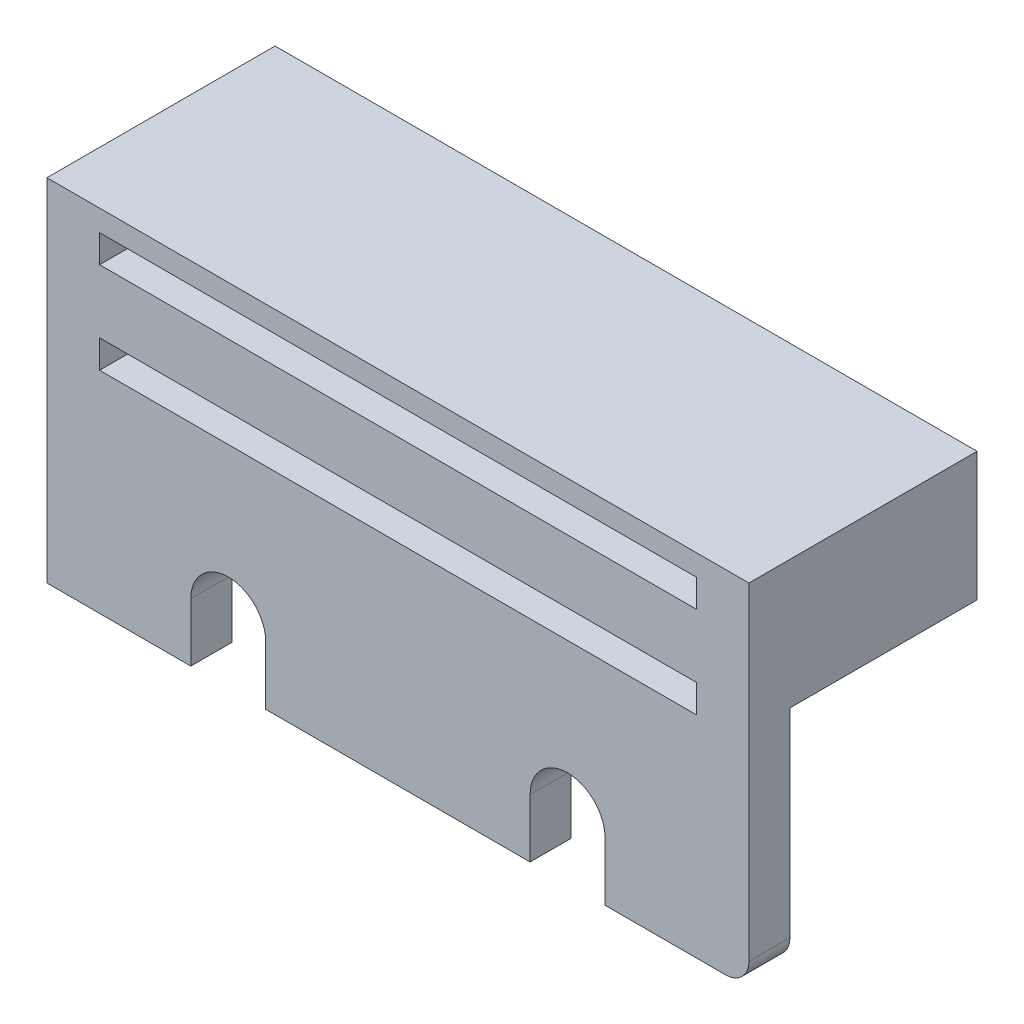
from build123d import *

# Parameters (mm, degrees)
BOSS_EXTRUDE1_DEPTH      = 27.75
BOSS_EXTRUDE1_DEPTH_BACK = 27.75
SKETCH1_W                = 30
SKETCH1_H                = 15
SKETCH3_W                = 4
SKETCH3_H                = 18.5
CUT_EXTRUDE2_DEPTH       = 43.072110715
CUT_EXTRUDE5_DEPTH       = 3
CUT_EXTRUDE6_START       = -3
CUT_EXTRUDE6_DEPTH       = 3
FILLET1_R                = 1
SKETCH7_W                = 52
SKETCH7_H                = 19
CUT_EXTRUDE8_DEPTH       = 43.072110715
SKETCH8_W                = 25.5
SKETCH8_H                = 1.2
SKETCH8_H_2              = 1.187456806
CUT_EXTRUDE9_DEPTH       = 21.495426319


with BuildPart() as part:
    # Sketch1 → Boss-Extrude1 (new, two sides: drawn at the far end of the back side and taken through both)
    with BuildSketch(Plane.XY.offset(-BOSS_EXTRUDE1_DEPTH_BACK)):
        with Locations((0, -2.5)):
            Rectangle(SKETCH1_W, SKETCH1_H)
    extrude(amount=BOSS_EXTRUDE1_DEPTH + BOSS_EXTRUDE1_DEPTH_BACK)

    # Sketch3 → Cut-Extrude2 (cut, through all)
    with BuildSketch(Plane(origin=(15, 0, 0), x_dir=(0, 0, -1), z_dir=(1, 0, 0))):
        with Locations((24, -10)):
            Rectangle(SKETCH3_W, SKETCH3_H)
        with Locations((-24, -10)):
            Rectangle(SKETCH3_W, SKETCH3_H)
    extrude(amount=-CUT_EXTRUDE2_DEPTH, mode=Mode.SUBTRACT)

    # Sketch2 → Cut-Extrude5 (cut)
    with BuildSketch(Plane.XY.offset(27.75)):
        with BuildLine():
            Line((-8.85, -12.5), (-8.85, -7.5))
            ThreePointArc((-8.85, -7.5), (-7.25, -5.9), (-5.65, -7.5))
            Line((-5.65, -7.5), (-5.65, -12.5))
            ThreePointArc((-5.65, -12.5), (-7.25, -14.1), (-8.85, -12.5))
        make_face()
        with BuildLine():
            Line((5.65, -12.5), (5.65, -7.5))
            ThreePointArc((5.65, -7.5), (7.25, -5.9), (8.85, -7.5))
            Line((8.85, -7.5), (8.85, -12.5))
            ThreePointArc((8.85, -12.5), (7.25, -14.1), (5.65, -12.5))
        make_face()
    extrude(amount=-CUT_EXTRUDE5_DEPTH, mode=Mode.SUBTRACT)

    # Sketch5 → Cut-Extrude6 (cut)
    with BuildSketch(Plane(origin=(0, 0, -27.75), x_dir=(-1, 0, 0), z_dir=(0, 0, -1)).offset(CUT_EXTRUDE6_START)):
        with BuildLine():
            Line((-8.85, -12.5), (-8.85, -7.5))
            ThreePointArc((-8.85, -7.5), (-7.25, -5.9), (-5.65, -7.5))
            Line((-5.65, -7.5), (-5.65, -12.5))
            ThreePointArc((-5.65, -12.5), (-7.25, -14.1), (-8.85, -12.5))
        make_face()
        with BuildLine():
            Line((5.65, -12.5), (5.65, -7.5))
            ThreePointArc((5.65, -7.5), (7.25, -5.9), (8.85, -7.5))
            Line((8.85, -7.5), (8.85, -12.5))
            ThreePointArc((8.85, -12.5), (7.25, -14.1), (5.65, -12.5))
        make_face()
    extrude(amount=CUT_EXTRUDE6_DEPTH, mode=Mode.SUBTRACT)

    # Fillet1
    fillet1_edges = [part.edges().sort_by_distance(p)[0] for p in [
        (15, -10, 26.875),
    ]]
    fillet(fillet1_edges, radius=FILLET1_R)

    # Sketch7 → Cut-Extrude8 (cut, through all)
    with BuildSketch(Plane(origin=(15, 0, 0), x_dir=(0, 0, -1), z_dir=(1, 0, 0))):
        with Locations((0, -10)):
            Rectangle(SKETCH7_W, SKETCH7_H)
    extrude(amount=-CUT_EXTRUDE8_DEPTH, mode=Mode.SUBTRACT)

    # SurfaceCut1
    split(bisect_by=Plane.XY.offset(18), keep=Keep.TOP)

    # Sketch8 → Cut-Extrude9 (cut, through all)
    with BuildSketch(Plane.XY.offset(27.75)):
        with Locations((0, -0.4)):
            Rectangle(SKETCH8_W, SKETCH8_H)
        with Locations((0, 3.5)):
            Rectangle(SKETCH8_W, SKETCH8_H_2)
    extrude(amount=-CUT_EXTRUDE9_DEPTH, mode=Mode.SUBTRACT)


solid = part.part
